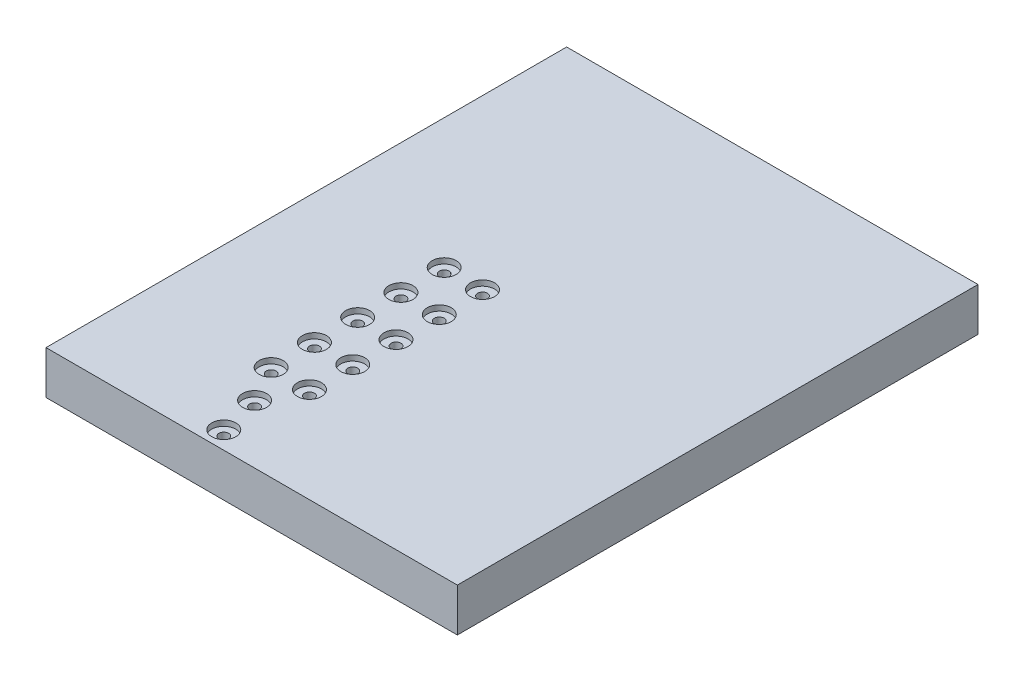
from build123d import *

# Parameters (mm, degrees)
SKETCH1_W           = 95.084546548
SKETCH1_H           = 120.353236263
BOSS_EXTRUDE1_DEPTH = 10
LPATTERN1_COUNT     = 5
LPATTERN1_PITCH     = 10
CIRPATTERN1_COUNT   = 5
CIRPATTERN1_ANGLE   = 60


with BuildPart() as part:
    # Sketch1 → Boss-Extrude1 (new body)
    with BuildSketch(Plane(origin=(0, 0, 0), x_dir=(1, 0, 0), z_dir=(0, 1, 0))):
        with Locations((13.112304348, -23.734650464)):
            Rectangle(SKETCH1_W, SKETCH1_H)
    extrude(amount=BOSS_EXTRUDE1_DEPTH)

    # Sketch3 → CBORE for #2 Binding Head Machine Screw1 (revolve, cut)
    with BuildSketch(Plane(origin=(-4.429968926, 10, 61.864899381), x_dir=(0, 0, 1), z_dir=(1, 0, 0))):
        Polygon((0, 0), (0, 3.679152758), (1.1303, 3), (1.1303, 1.27), (2.77876, 1.27), (2.77876, 0), align=None)
    cbore_for_2_binding_head_machine_screw1 = revolve(axis=Axis((-4.429968926, 16.35, 61.864899381), (0, -1, 0)), mode=Mode.SUBTRACT)

    # LPattern1: CBORE for #2 Binding Head Machine Screw1 ×5
    with Locations(*[(0, 0, -i * LPATTERN1_PITCH) for i in range(1, LPATTERN1_COUNT)]):
        add(cbore_for_2_binding_head_machine_screw1, mode=Mode.SUBTRACT)

    # CirPattern1: CBORE for #2 Binding Head Machine Screw1 ×5 about axis, 2 skipped
    cirpattern1_axis = Axis((-34.429968926, 0, 83.911268596), (0, -1, 0))
    add([cbore_for_2_binding_head_machine_screw1.rotate(cirpattern1_axis, i * CIRPATTERN1_ANGLE / (CIRPATTERN1_COUNT - 1)) for i in range(1, CIRPATTERN1_COUNT) if i not in (3, 4)], mode=Mode.SUBTRACT)

    # Mirror1: CBORE for #2 Binding Head Machine Screw1 across plane
    add(cbore_for_2_binding_head_machine_screw1.mirror(Plane(origin=(0, 0, 0), x_dir=(0, 0, 1), z_dir=(1, 0, 0))), mode=Mode.SUBTRACT)

    # Mirror1 copy 1 sketch → Mirror1 copy 1 (revolve, cut)
    with BuildSketch(Plane(origin=(4.429968926, 10, 51.864899381), x_dir=(0, 0, 1), z_dir=(-1, 0, 0))):
        Polygon((0, 0), (0, -3.679152758), (1.1303, -3), (1.1303, -1.27), (2.77876, -1.27), (2.77876, 0), align=None)
    revolve(axis=Axis((4.429968926, 16.35, 51.864899381), (0, 1, 0)), mode=Mode.SUBTRACT)

    # Mirror1 copy 2 sketch → Mirror1 copy 2 (revolve, cut)
    with BuildSketch(Plane(origin=(4.429968926, 10, 41.864899381), x_dir=(0, 0, 1), z_dir=(-1, 0, 0))):
        Polygon((0, 0), (0, -3.679152758), (1.1303, -3), (1.1303, -1.27), (2.77876, -1.27), (2.77876, 0), align=None)
    revolve(axis=Axis((4.429968926, 16.35, 41.864899381), (0, 1, 0)), mode=Mode.SUBTRACT)

    # Mirror1 copy 3 sketch → Mirror1 copy 3 (revolve, cut)
    with BuildSketch(Plane(origin=(4.429968926, 10, 31.864899381), x_dir=(0, 0, 1), z_dir=(-1, 0, 0))):
        Polygon((0, 0), (0, -3.679152758), (1.1303, -3), (1.1303, -1.27), (2.77876, -1.27), (2.77876, 0), align=None)
    revolve(axis=Axis((4.429968926, 16.35, 31.864899381), (0, 1, 0)), mode=Mode.SUBTRACT)

    # Mirror1 copy 4 sketch → Mirror1 copy 4 (revolve, cut)
    with BuildSketch(Plane(origin=(4.429968926, 10, 21.864899381), x_dir=(0, 0, 1), z_dir=(-1, 0, 0))):
        Polygon((0, 0), (0, -3.679152758), (1.1303, -3), (1.1303, -1.27), (2.77876, -1.27), (2.77876, 0), align=None)
    revolve(axis=Axis((4.429968926, 16.35, 21.864899381), (0, 1, 0)), mode=Mode.SUBTRACT)


solid = part.part
